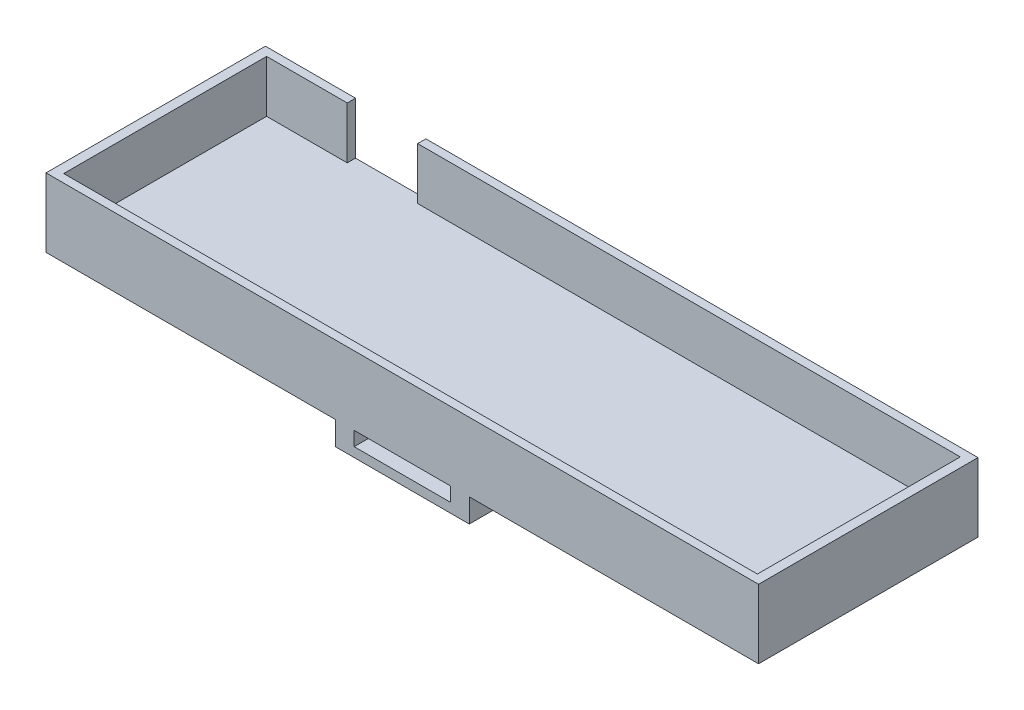
from build123d import *

# Parameters (mm, degrees)
SKETCH_1_W          = 151
SKETCH_1_H          = 46.5
EXTRUDE_1_DEPTH     = 14.6
SKETCH_5_W          = 4
SKETCH_5_H          = 13.25
EXTRUDE_5_DEPTH     = 3
SKETCH1_W           = 147
SKETCH1_H           = 43
CUT_EXTRUDE1_DEPTH  = 11
SKETCH2_W           = 14.914313068
SKETCH2_H           = 1.75
CUT_EXTRUDE2_DEPTH  = 11
SKETCH_8_W          = 28.4
SKETCH_8_H          = 46.5
BOSS_EXTRUDE1_DEPTH = 2


with BuildPart() as part:
    # 草图1 → 凸台-拉伸1 (new body)
    with BuildSketch(Plane(origin=(0, 0, 0), x_dir=(1, 0, 0), z_dir=(0, 1, 0))):
        Rectangle(SKETCH_1_W, SKETCH_1_H)
    extrude(amount=EXTRUDE_1_DEPTH)

    # 草图5 → 凸台-拉伸5 (add)
    with BuildSketch(Plane(origin=(0, 0, 0), x_dir=(-1, 0, 0), z_dir=(0, -1, 0))):
        with Locations((-12.2, -16.625)):
            Rectangle(SKETCH_5_W, SKETCH_5_H)
        with Locations((12.2, -16.625)):
            Rectangle(SKETCH_5_W, SKETCH_5_H)
        with Locations((-12.2, 16.625)):
            Rectangle(SKETCH_5_W, SKETCH_5_H)
        with Locations((12.2, 16.625)):
            Rectangle(SKETCH_5_W, SKETCH_5_H)
    extrude(amount=EXTRUDE_5_DEPTH)

    # Sketch1 → Cut-Extrude1 (cut)
    with BuildSketch(Plane(origin=(0, 14.6, 0), x_dir=(1, 0, 0), z_dir=(0, 1, 0))):
        Rectangle(SKETCH1_W, SKETCH1_H)
    extrude(amount=-CUT_EXTRUDE1_DEPTH, mode=Mode.SUBTRACT)

    # Sketch2 → Cut-Extrude2 (cut)
    with BuildSketch(Plane(origin=(0, 14.6, 0), x_dir=(1, 0, 0), z_dir=(0, 1, 0))):
        with Locations((-48.957156534, 22.375)):
            Rectangle(SKETCH2_W, SKETCH2_H)
    extrude(amount=-CUT_EXTRUDE2_DEPTH, mode=Mode.SUBTRACT)

    # 草图8 → Boss-Extrude1 (add)
    with BuildSketch(Plane(origin=(0, -3, 0), x_dir=(-1, 0, 0), z_dir=(0, -1, 0))):
        Rectangle(SKETCH_8_W, SKETCH_8_H)
    extrude(amount=BOSS_EXTRUDE1_DEPTH)


solid = part.part
